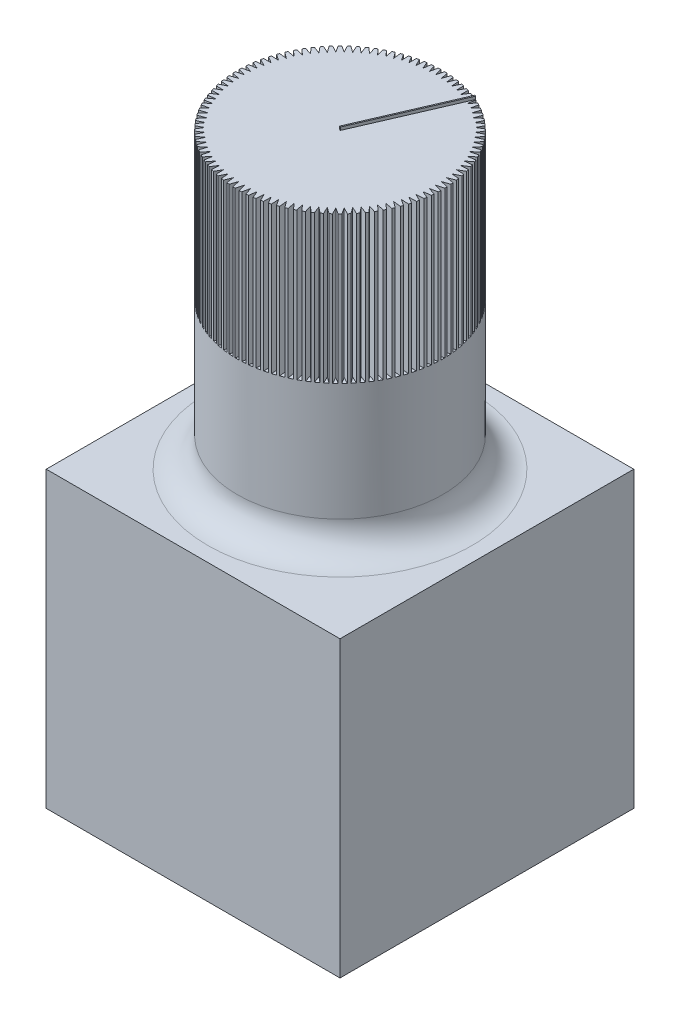
from build123d import *

# Parameters (mm, degrees)
SKETCH1_W           = 10
SKETCH1_H           = 10
BOSS_EXTRUDE1_DEPTH = 10
SKETCH2_R           = 3.5
BOSS_EXTRUDE2_DEPTH = 10
FILLET1_R           = 1
CUT_EXTRUDE3_START  = -5
CUT_EXTRUDE3_DEPTH  = 5
BOSS_EXTRUDE3_DEPTH = 0.1


with BuildPart() as part:
    # Sketch1 → Boss-Extrude1 (new body)
    with BuildSketch(Plane(origin=(0, 0, 0), x_dir=(1, 0, 0), z_dir=(0, 1, 0))):
        Rectangle(SKETCH1_W, SKETCH1_H)
    extrude(amount=BOSS_EXTRUDE1_DEPTH)

    # Sketch2 → Boss-Extrude2 (add)
    with BuildSketch(Plane(origin=(0, 10, 0), x_dir=(1, 0, 0), z_dir=(0, 1, 0))):
        Circle(SKETCH2_R)
    extrude(amount=BOSS_EXTRUDE2_DEPTH)

    # Fillet1
    fillet1_edges = [part.edges().sort_by_distance(p)[0] for p in [
        (-3.5, 10, 0),
    ]]
    fillet(fillet1_edges, radius=FILLET1_R)

    # Sketch5 → Cut-Extrude3 (cut)
    with BuildSketch(Plane(origin=(0, 20, 0), x_dir=(1, 0, 0), z_dir=(0, 1, 0)).offset(CUT_EXTRUDE3_START)):
        with BuildLine():
            Line((0, 3.25), (-0.066816391, 3.499362166))
            ThreePointArc((-0.066816391, 3.499362166), (0, 3.5), (0.066816391, 3.499362166))
            Line((0.066816391, 3.499362166), (0, 3.25))
        make_face()
        with BuildLine():
            Line((0.204069188, 3.243586867), (0.153042224, 3.49665241))
            ThreePointArc((0.153042224, 3.49665241), (0.219766818, 3.493093549), (0.286411313, 3.488261538))
            Line((0.286411313, 3.488261538), (0.204069188, 3.243586867))
        make_face()
        with BuildLine():
            Line((0.407333009, 3.224372779), (0.372296852, 3.480142965))
            ThreePointArc((0.372296852, 3.480142965), (0.438666317, 3.472401455), (0.5048759, 3.463394336))
            Line((0.5048759, 3.463394336), (0.407333009, 3.224372779))
        make_face()
        with BuildLine():
            Line((0.608989272, 3.192433565), (0.590082194, 3.449898985))
            ThreePointArc((0.590082194, 3.449898985), (0.655834601, 3.438005378), (0.721347972, 3.424858698))
            Line((0.721347972, 3.424858698), (0.608989272, 3.192433565))
        make_face()
        with BuildLine():
            Line((0.808242133, 3.147895274), (0.805538751, 3.40603983))
            ThreePointArc((0.805538751, 3.40603983), (0.870414605, 3.390041064), (0.934973214, 3.372806708))
            Line((0.934973214, 3.372806708), (0.808242133, 3.147895274))
        make_face()
        with BuildLine():
            Line((1.004305232, 3.090933678), (1.017816215, 3.348738591))
            ThreePointArc((1.017816215, 3.348738591), (1.08155948, 3.328697807), (1.144908543, 3.307443791))
            Line((1.144908543, 3.307443791), (1.004305232, 3.090933678))
        make_face()
        with BuildLine():
            Line((1.196404796, 3.021773579), (1.226076823, 3.278221412))
            ThreePointArc((1.226076823, 3.278221412), (1.288435934, 3.254217701), (1.350325441, 3.229027904))
            Line((1.350325441, 3.229027904), (1.196404796, 3.021773579))
        make_face()
        with BuildLine():
            Line((1.383782698, 2.940687921), (1.429498666, 3.19476659))
            ThreePointArc((1.429498666, 3.19476659), (1.49022752, 3.166894684), (1.550413222, 3.137868519))
            Line((1.550413222, 3.137868519), (1.383782698, 2.940687921))
        make_face()
        with BuildLine():
            Line((1.565699441, 2.84799671), (1.627278931, 3.098703484))
            ThreePointArc((1.627278931, 3.098703484), (1.686137859, 3.06707338), (1.74438223, 3.0343254))
            Line((1.74438223, 3.0343254), (1.565699441, 2.84799671))
        make_face()
        with BuildLine():
            Line((1.741437084, 2.744065758), (1.818637069, 2.990411211))
            ThreePointArc((1.818637069, 2.990411211), (1.875393782, 2.955147739), (1.931466959, 2.918807186))
            Line((1.931466959, 2.918807186), (1.741437084, 2.744065758))
        make_face()
        with BuildLine():
            Line((1.91030207, 2.629305232), (2.002817878, 2.870317151))
            ThreePointArc((2.002817878, 2.870317151), (2.057248383, 2.83155948), (2.11092907, 2.791769773))
            Line((2.11092907, 2.791769773), (1.91030207, 2.629305232))
        make_face()
        with BuildLine():
            Line((2.071627967, 2.504168039), (2.179094479, 2.738895261))
            ThreePointArc((2.179094479, 2.738895261), (2.230983964, 2.69679635), (2.282060308, 2.65371452))
            Line((2.282060308, 2.65371452), (2.071627967, 2.504168039))
        make_face()
        with BuildLine():
            Line((2.224778094, 2.369148039), (2.346771191, 2.596664202))
            ThreePointArc((2.346771191, 2.596664202), (2.395914871, 2.551390196), (2.444185296, 2.505186268))
            Line((2.444185296, 2.505186268), (2.224778094, 2.369148039))
        make_face()
        with BuildLine():
            Line((2.369148039, 2.224778094), (2.505186268, 2.444185296))
            ThreePointArc((2.505186268, 2.444185296), (2.551390196, 2.395914871), (2.596664202, 2.346771191))
            Line((2.596664202, 2.346771191), (2.369148039, 2.224778094))
        make_face()
        with BuildLine():
            Line((2.504168039, 2.071627967), (2.65371452, 2.282060308))
            ThreePointArc((2.65371452, 2.282060308), (2.69679635, 2.230983964), (2.738895261, 2.179094479))
            Line((2.738895261, 2.179094479), (2.504168039, 2.071627967))
        make_face()
        with BuildLine():
            Line((2.629305232, 1.91030207), (2.791769773, 2.11092907))
            ThreePointArc((2.791769773, 2.11092907), (2.83155948, 2.057248383), (2.870317151, 2.002817878))
            Line((2.870317151, 2.002817878), (2.629305232, 1.91030207))
        make_face()
        with BuildLine():
            Line((2.744065758, 1.741437084), (2.918807186, 1.931466959))
            ThreePointArc((2.918807186, 1.931466959), (2.955147739, 1.875393782), (2.990411211, 1.818637069))
            Line((2.990411211, 1.818637069), (2.744065758, 1.741437084))
        make_face()
        with BuildLine():
            Line((2.84799671, 1.565699441), (3.0343254, 1.74438223))
            ThreePointArc((3.0343254, 1.74438223), (3.06707338, 1.686137859), (3.098703484, 1.627278931))
            Line((3.098703484, 1.627278931), (2.84799671, 1.565699441))
        make_face()
        with BuildLine():
            Line((2.940687921, 1.383782698), (3.137868519, 1.550413222))
            ThreePointArc((3.137868519, 1.550413222), (3.166894684, 1.49022752), (3.19476659, 1.429498666))
            Line((3.19476659, 1.429498666), (2.940687921, 1.383782698))
        make_face()
        with BuildLine():
            Line((3.021773579, 1.196404796), (3.229027904, 1.350325441))
            ThreePointArc((3.229027904, 1.350325441), (3.254217701, 1.288435934), (3.278221412, 1.226076823))
            Line((3.278221412, 1.226076823), (3.021773579, 1.196404796))
        make_face()
        with BuildLine():
            Line((3.090933678, 1.004305232), (3.307443791, 1.144908543))
            ThreePointArc((3.307443791, 1.144908543), (3.328697807, 1.08155948), (3.348738591, 1.017816215))
            Line((3.348738591, 1.017816215), (3.090933678, 1.004305232))
        make_face()
        with BuildLine():
            Line((3.147895274, 0.808242133), (3.372806708, 0.934973214))
            ThreePointArc((3.372806708, 0.934973214), (3.390041064, 0.870414605), (3.40603983, 0.805538751))
            Line((3.40603983, 0.805538751), (3.147895274, 0.808242133))
        make_face()
        with BuildLine():
            Line((3.192433565, 0.608989272), (3.424858698, 0.721347972))
            ThreePointArc((3.424858698, 0.721347972), (3.438005378, 0.655834601), (3.449898985, 0.590082194))
            Line((3.449898985, 0.590082194), (3.192433565, 0.608989272))
        make_face()
        with BuildLine():
            Line((3.224372779, 0.407333009), (3.463394336, 0.5048759))
            ThreePointArc((3.463394336, 0.5048759), (3.472401455, 0.438666317), (3.480142965, 0.372296852))
            Line((3.480142965, 0.372296852), (3.224372779, 0.407333009))
        make_face()
        with BuildLine():
            Line((3.243586867, 0.204069188), (3.488261538, 0.286411313))
            ThreePointArc((3.488261538, 0.286411313), (3.493093549, 0.219766818), (3.49665241, 0.153042224))
            Line((3.49665241, 0.153042224), (3.243586867, 0.204069188))
        make_face()
        with BuildLine():
            Line((3.25, 0), (3.499362166, 0.066816391))
            ThreePointArc((3.499362166, 0.066816391), (3.5, 0), (3.499362166, -0.066816391))
            Line((3.499362166, -0.066816391), (3.25, 0))
        make_face()
        with BuildLine():
            Line((3.243586867, -0.204069188), (3.49665241, -0.153042224))
            ThreePointArc((3.49665241, -0.153042224), (3.493093549, -0.219766818), (3.488261538, -0.286411313))
            Line((3.488261538, -0.286411313), (3.243586867, -0.204069188))
        make_face()
        with BuildLine():
            Line((3.224372779, -0.407333009), (3.480142965, -0.372296852))
            ThreePointArc((3.480142965, -0.372296852), (3.472401455, -0.438666317), (3.463394336, -0.5048759))
            Line((3.463394336, -0.5048759), (3.224372779, -0.407333009))
        make_face()
        with BuildLine():
            Line((3.192433565, -0.608989272), (3.449898985, -0.590082194))
            ThreePointArc((3.449898985, -0.590082194), (3.438005378, -0.655834601), (3.424858698, -0.721347972))
            Line((3.424858698, -0.721347972), (3.192433565, -0.608989272))
        make_face()
        with BuildLine():
            Line((3.147895274, -0.808242133), (3.40603983, -0.805538751))
            ThreePointArc((3.40603983, -0.805538751), (3.390041064, -0.870414605), (3.372806708, -0.934973214))
            Line((3.372806708, -0.934973214), (3.147895274, -0.808242133))
        make_face()
        with BuildLine():
            Line((3.090933678, -1.004305232), (3.348738591, -1.017816215))
            ThreePointArc((3.348738591, -1.017816215), (3.328697807, -1.08155948), (3.307443791, -1.144908543))
            Line((3.307443791, -1.144908543), (3.090933678, -1.004305232))
        make_face()
        with BuildLine():
            Line((3.021773579, -1.196404796), (3.278221412, -1.226076823))
            ThreePointArc((3.278221412, -1.226076823), (3.254217701, -1.288435934), (3.229027904, -1.350325441))
            Line((3.229027904, -1.350325441), (3.021773579, -1.196404796))
        make_face()
        with BuildLine():
            Line((2.940687921, -1.383782698), (3.19476659, -1.429498666))
            ThreePointArc((3.19476659, -1.429498666), (3.166894684, -1.49022752), (3.137868519, -1.550413222))
            Line((3.137868519, -1.550413222), (2.940687921, -1.383782698))
        make_face()
        with BuildLine():
            Line((2.84799671, -1.565699441), (3.098703484, -1.627278931))
            ThreePointArc((3.098703484, -1.627278931), (3.06707338, -1.686137859), (3.0343254, -1.74438223))
            Line((3.0343254, -1.74438223), (2.84799671, -1.565699441))
        make_face()
        with BuildLine():
            Line((2.744065758, -1.741437084), (2.990411211, -1.818637069))
            ThreePointArc((2.990411211, -1.818637069), (2.955147739, -1.875393782), (2.918807186, -1.931466959))
            Line((2.918807186, -1.931466959), (2.744065758, -1.741437084))
        make_face()
        with BuildLine():
            Line((2.629305232, -1.91030207), (2.870317151, -2.002817878))
            ThreePointArc((2.870317151, -2.002817878), (2.83155948, -2.057248383), (2.791769773, -2.11092907))
            Line((2.791769773, -2.11092907), (2.629305232, -1.91030207))
        make_face()
        with BuildLine():
            Line((2.504168039, -2.071627967), (2.738895261, -2.179094479))
            ThreePointArc((2.738895261, -2.179094479), (2.69679635, -2.230983964), (2.65371452, -2.282060308))
            Line((2.65371452, -2.282060308), (2.504168039, -2.071627967))
        make_face()
        with BuildLine():
            Line((2.369148039, -2.224778094), (2.596664202, -2.346771191))
            ThreePointArc((2.596664202, -2.346771191), (2.551390196, -2.395914871), (2.505186268, -2.444185296))
            Line((2.505186268, -2.444185296), (2.369148039, -2.224778094))
        make_face()
        with BuildLine():
            Line((2.224778094, -2.369148039), (2.444185296, -2.505186268))
            ThreePointArc((2.444185296, -2.505186268), (2.395914871, -2.551390196), (2.346771191, -2.596664202))
            Line((2.346771191, -2.596664202), (2.224778094, -2.369148039))
        make_face()
        with BuildLine():
            Line((2.071627967, -2.504168039), (2.282060308, -2.65371452))
            ThreePointArc((2.282060308, -2.65371452), (2.230983964, -2.69679635), (2.179094479, -2.738895261))
            Line((2.179094479, -2.738895261), (2.071627967, -2.504168039))
        make_face()
        with BuildLine():
            Line((1.91030207, -2.629305232), (2.11092907, -2.791769773))
            ThreePointArc((2.11092907, -2.791769773), (2.057248383, -2.83155948), (2.002817878, -2.870317151))
            Line((2.002817878, -2.870317151), (1.91030207, -2.629305232))
        make_face()
        with BuildLine():
            Line((1.741437084, -2.744065758), (1.931466959, -2.918807186))
            ThreePointArc((1.931466959, -2.918807186), (1.875393782, -2.955147739), (1.818637069, -2.990411211))
            Line((1.818637069, -2.990411211), (1.741437084, -2.744065758))
        make_face()
        with BuildLine():
            Line((1.565699441, -2.84799671), (1.74438223, -3.0343254))
            ThreePointArc((1.74438223, -3.0343254), (1.686137859, -3.06707338), (1.627278931, -3.098703484))
            Line((1.627278931, -3.098703484), (1.565699441, -2.84799671))
        make_face()
        with BuildLine():
            Line((1.383782698, -2.940687921), (1.550413222, -3.137868519))
            ThreePointArc((1.550413222, -3.137868519), (1.49022752, -3.166894684), (1.429498666, -3.19476659))
            Line((1.429498666, -3.19476659), (1.383782698, -2.940687921))
        make_face()
        with BuildLine():
            Line((1.196404796, -3.021773579), (1.350325441, -3.229027904))
            ThreePointArc((1.350325441, -3.229027904), (1.288435934, -3.254217701), (1.226076823, -3.278221412))
            Line((1.226076823, -3.278221412), (1.196404796, -3.021773579))
        make_face()
        with BuildLine():
            Line((1.004305232, -3.090933678), (1.144908543, -3.307443791))
            ThreePointArc((1.144908543, -3.307443791), (1.08155948, -3.328697807), (1.017816215, -3.348738591))
            Line((1.017816215, -3.348738591), (1.004305232, -3.090933678))
        make_face()
        with BuildLine():
            Line((0.808242133, -3.147895274), (0.934973214, -3.372806708))
            ThreePointArc((0.934973214, -3.372806708), (0.870414605, -3.390041064), (0.805538751, -3.40603983))
            Line((0.805538751, -3.40603983), (0.808242133, -3.147895274))
        make_face()
        with BuildLine():
            Line((0.608989272, -3.192433565), (0.721347972, -3.424858698))
            ThreePointArc((0.721347972, -3.424858698), (0.655834601, -3.438005378), (0.590082194, -3.449898985))
            Line((0.590082194, -3.449898985), (0.608989272, -3.192433565))
        make_face()
        with BuildLine():
            Line((0.407333009, -3.224372779), (0.5048759, -3.463394336))
            ThreePointArc((0.5048759, -3.463394336), (0.438666317, -3.472401455), (0.372296852, -3.480142965))
            Line((0.372296852, -3.480142965), (0.407333009, -3.224372779))
        make_face()
        with BuildLine():
            Line((0.204069188, -3.243586867), (0.286411313, -3.488261538))
            ThreePointArc((0.286411313, -3.488261538), (0.219766818, -3.493093549), (0.153042224, -3.49665241))
            Line((0.153042224, -3.49665241), (0.204069188, -3.243586867))
        make_face()
        with BuildLine():
            Line((0, -3.25), (0.066816391, -3.499362166))
            ThreePointArc((0.066816391, -3.499362166), (0, -3.5), (-0.066816391, -3.499362166))
            Line((-0.066816391, -3.499362166), (0, -3.25))
        make_face()
        with BuildLine():
            Line((-0.204069188, -3.243586867), (-0.153042224, -3.49665241))
            ThreePointArc((-0.153042224, -3.49665241), (-0.219766818, -3.493093549), (-0.286411313, -3.488261538))
            Line((-0.286411313, -3.488261538), (-0.204069188, -3.243586867))
        make_face()
        with BuildLine():
            Line((-0.407333009, -3.224372779), (-0.372296852, -3.480142965))
            ThreePointArc((-0.372296852, -3.480142965), (-0.438666317, -3.472401455), (-0.5048759, -3.463394336))
            Line((-0.5048759, -3.463394336), (-0.407333009, -3.224372779))
        make_face()
        with BuildLine():
            Line((-0.608989272, -3.192433565), (-0.590082194, -3.449898985))
            ThreePointArc((-0.590082194, -3.449898985), (-0.655834601, -3.438005378), (-0.721347972, -3.424858698))
            Line((-0.721347972, -3.424858698), (-0.608989272, -3.192433565))
        make_face()
        with BuildLine():
            Line((-0.808242133, -3.147895274), (-0.805538751, -3.40603983))
            ThreePointArc((-0.805538751, -3.40603983), (-0.870414605, -3.390041064), (-0.934973214, -3.372806708))
            Line((-0.934973214, -3.372806708), (-0.808242133, -3.147895274))
        make_face()
        with BuildLine():
            Line((-1.004305232, -3.090933678), (-1.017816215, -3.348738591))
            ThreePointArc((-1.017816215, -3.348738591), (-1.08155948, -3.328697807), (-1.144908543, -3.307443791))
            Line((-1.144908543, -3.307443791), (-1.004305232, -3.090933678))
        make_face()
        with BuildLine():
            Line((-1.196404796, -3.021773579), (-1.226076823, -3.278221412))
            ThreePointArc((-1.226076823, -3.278221412), (-1.288435934, -3.254217701), (-1.350325441, -3.229027904))
            Line((-1.350325441, -3.229027904), (-1.196404796, -3.021773579))
        make_face()
        with BuildLine():
            Line((-1.383782698, -2.940687921), (-1.429498666, -3.19476659))
            ThreePointArc((-1.429498666, -3.19476659), (-1.49022752, -3.166894684), (-1.550413222, -3.137868519))
            Line((-1.550413222, -3.137868519), (-1.383782698, -2.940687921))
        make_face()
        with BuildLine():
            Line((-1.565699441, -2.84799671), (-1.627278931, -3.098703484))
            ThreePointArc((-1.627278931, -3.098703484), (-1.686137859, -3.06707338), (-1.74438223, -3.0343254))
            Line((-1.74438223, -3.0343254), (-1.565699441, -2.84799671))
        make_face()
        with BuildLine():
            Line((-1.741437084, -2.744065758), (-1.818637069, -2.990411211))
            ThreePointArc((-1.818637069, -2.990411211), (-1.875393782, -2.955147739), (-1.931466959, -2.918807186))
            Line((-1.931466959, -2.918807186), (-1.741437084, -2.744065758))
        make_face()
        with BuildLine():
            Line((-1.91030207, -2.629305232), (-2.002817878, -2.870317151))
            ThreePointArc((-2.002817878, -2.870317151), (-2.057248383, -2.83155948), (-2.11092907, -2.791769773))
            Line((-2.11092907, -2.791769773), (-1.91030207, -2.629305232))
        make_face()
        with BuildLine():
            Line((-2.071627967, -2.504168039), (-2.179094479, -2.738895261))
            ThreePointArc((-2.179094479, -2.738895261), (-2.230983964, -2.69679635), (-2.282060308, -2.65371452))
            Line((-2.282060308, -2.65371452), (-2.071627967, -2.504168039))
        make_face()
        with BuildLine():
            Line((-2.224778094, -2.369148039), (-2.346771191, -2.596664202))
            ThreePointArc((-2.346771191, -2.596664202), (-2.395914871, -2.551390196), (-2.444185296, -2.505186268))
            Line((-2.444185296, -2.505186268), (-2.224778094, -2.369148039))
        make_face()
        with BuildLine():
            Line((-2.369148039, -2.224778094), (-2.505186268, -2.444185296))
            ThreePointArc((-2.505186268, -2.444185296), (-2.551390196, -2.395914871), (-2.596664202, -2.346771191))
            Line((-2.596664202, -2.346771191), (-2.369148039, -2.224778094))
        make_face()
        with BuildLine():
            Line((-2.504168039, -2.071627967), (-2.65371452, -2.282060308))
            ThreePointArc((-2.65371452, -2.282060308), (-2.69679635, -2.230983964), (-2.738895261, -2.179094479))
            Line((-2.738895261, -2.179094479), (-2.504168039, -2.071627967))
        make_face()
        with BuildLine():
            Line((-2.629305232, -1.91030207), (-2.791769773, -2.11092907))
            ThreePointArc((-2.791769773, -2.11092907), (-2.83155948, -2.057248383), (-2.870317151, -2.002817878))
            Line((-2.870317151, -2.002817878), (-2.629305232, -1.91030207))
        make_face()
        with BuildLine():
            Line((-2.744065758, -1.741437084), (-2.918807186, -1.931466959))
            ThreePointArc((-2.918807186, -1.931466959), (-2.955147739, -1.875393782), (-2.990411211, -1.818637069))
            Line((-2.990411211, -1.818637069), (-2.744065758, -1.741437084))
        make_face()
        with BuildLine():
            Line((-2.84799671, -1.565699441), (-3.0343254, -1.74438223))
            ThreePointArc((-3.0343254, -1.74438223), (-3.06707338, -1.686137859), (-3.098703484, -1.627278931))
            Line((-3.098703484, -1.627278931), (-2.84799671, -1.565699441))
        make_face()
        with BuildLine():
            Line((-2.940687921, -1.383782698), (-3.137868519, -1.550413222))
            ThreePointArc((-3.137868519, -1.550413222), (-3.166894684, -1.49022752), (-3.19476659, -1.429498666))
            Line((-3.19476659, -1.429498666), (-2.940687921, -1.383782698))
        make_face()
        with BuildLine():
            Line((-3.021773579, -1.196404796), (-3.229027904, -1.350325441))
            ThreePointArc((-3.229027904, -1.350325441), (-3.254217701, -1.288435934), (-3.278221412, -1.226076823))
            Line((-3.278221412, -1.226076823), (-3.021773579, -1.196404796))
        make_face()
        with BuildLine():
            Line((-3.090933678, -1.004305232), (-3.307443791, -1.144908543))
            ThreePointArc((-3.307443791, -1.144908543), (-3.328697807, -1.08155948), (-3.348738591, -1.017816215))
            Line((-3.348738591, -1.017816215), (-3.090933678, -1.004305232))
        make_face()
        with BuildLine():
            Line((-3.147895274, -0.808242133), (-3.372806708, -0.934973214))
            ThreePointArc((-3.372806708, -0.934973214), (-3.390041064, -0.870414605), (-3.40603983, -0.805538751))
            Line((-3.40603983, -0.805538751), (-3.147895274, -0.808242133))
        make_face()
        with BuildLine():
            Line((-3.192433565, -0.608989272), (-3.424858698, -0.721347972))
            ThreePointArc((-3.424858698, -0.721347972), (-3.438005378, -0.655834601), (-3.449898985, -0.590082194))
            Line((-3.449898985, -0.590082194), (-3.192433565, -0.608989272))
        make_face()
        with BuildLine():
            Line((-3.224372779, -0.407333009), (-3.463394336, -0.5048759))
            ThreePointArc((-3.463394336, -0.5048759), (-3.472401455, -0.438666317), (-3.480142965, -0.372296852))
            Line((-3.480142965, -0.372296852), (-3.224372779, -0.407333009))
        make_face()
        with BuildLine():
            Line((-3.243586867, -0.204069188), (-3.488261538, -0.286411313))
            ThreePointArc((-3.488261538, -0.286411313), (-3.493093549, -0.219766818), (-3.49665241, -0.153042224))
            Line((-3.49665241, -0.153042224), (-3.243586867, -0.204069188))
        make_face()
        with BuildLine():
            Line((-3.25, 0), (-3.499362166, -0.066816391))
            ThreePointArc((-3.499362166, -0.066816391), (-3.5, 0), (-3.499362166, 0.066816391))
            Line((-3.499362166, 0.066816391), (-3.25, 0))
        make_face()
        with BuildLine():
            Line((-3.243586867, 0.204069188), (-3.49665241, 0.153042224))
            ThreePointArc((-3.49665241, 0.153042224), (-3.493093549, 0.219766818), (-3.488261538, 0.286411313))
            Line((-3.488261538, 0.286411313), (-3.243586867, 0.204069188))
        make_face()
        with BuildLine():
            Line((-3.224372779, 0.407333009), (-3.480142965, 0.372296852))
            ThreePointArc((-3.480142965, 0.372296852), (-3.472401455, 0.438666317), (-3.463394336, 0.5048759))
            Line((-3.463394336, 0.5048759), (-3.224372779, 0.407333009))
        make_face()
        with BuildLine():
            Line((-3.192433565, 0.608989272), (-3.449898985, 0.590082194))
            ThreePointArc((-3.449898985, 0.590082194), (-3.438005378, 0.655834601), (-3.424858698, 0.721347972))
            Line((-3.424858698, 0.721347972), (-3.192433565, 0.608989272))
        make_face()
        with BuildLine():
            Line((-3.147895274, 0.808242133), (-3.40603983, 0.805538751))
            ThreePointArc((-3.40603983, 0.805538751), (-3.390041064, 0.870414605), (-3.372806708, 0.934973214))
            Line((-3.372806708, 0.934973214), (-3.147895274, 0.808242133))
        make_face()
        with BuildLine():
            Line((-3.090933678, 1.004305232), (-3.348738591, 1.017816215))
            ThreePointArc((-3.348738591, 1.017816215), (-3.328697807, 1.08155948), (-3.307443791, 1.144908543))
            Line((-3.307443791, 1.144908543), (-3.090933678, 1.004305232))
        make_face()
        with BuildLine():
            Line((-3.021773579, 1.196404796), (-3.278221412, 1.226076823))
            ThreePointArc((-3.278221412, 1.226076823), (-3.254217701, 1.288435934), (-3.229027904, 1.350325441))
            Line((-3.229027904, 1.350325441), (-3.021773579, 1.196404796))
        make_face()
        with BuildLine():
            Line((-2.940687921, 1.383782698), (-3.19476659, 1.429498666))
            ThreePointArc((-3.19476659, 1.429498666), (-3.166894684, 1.49022752), (-3.137868519, 1.550413222))
            Line((-3.137868519, 1.550413222), (-2.940687921, 1.383782698))
        make_face()
        with BuildLine():
            Line((-2.84799671, 1.565699441), (-3.098703484, 1.627278931))
            ThreePointArc((-3.098703484, 1.627278931), (-3.06707338, 1.686137859), (-3.0343254, 1.74438223))
            Line((-3.0343254, 1.74438223), (-2.84799671, 1.565699441))
        make_face()
        with BuildLine():
            Line((-2.744065758, 1.741437084), (-2.990411211, 1.818637069))
            ThreePointArc((-2.990411211, 1.818637069), (-2.955147739, 1.875393782), (-2.918807186, 1.931466959))
            Line((-2.918807186, 1.931466959), (-2.744065758, 1.741437084))
        make_face()
        with BuildLine():
            Line((-2.629305232, 1.91030207), (-2.870317151, 2.002817878))
            ThreePointArc((-2.870317151, 2.002817878), (-2.83155948, 2.057248383), (-2.791769773, 2.11092907))
            Line((-2.791769773, 2.11092907), (-2.629305232, 1.91030207))
        make_face()
        with BuildLine():
            Line((-2.504168039, 2.071627967), (-2.738895261, 2.179094479))
            ThreePointArc((-2.738895261, 2.179094479), (-2.69679635, 2.230983964), (-2.65371452, 2.282060308))
            Line((-2.65371452, 2.282060308), (-2.504168039, 2.071627967))
        make_face()
        with BuildLine():
            Line((-2.369148039, 2.224778094), (-2.596664202, 2.346771191))
            ThreePointArc((-2.596664202, 2.346771191), (-2.551390196, 2.395914871), (-2.505186268, 2.444185296))
            Line((-2.505186268, 2.444185296), (-2.369148039, 2.224778094))
        make_face()
        with BuildLine():
            Line((-2.224778094, 2.369148039), (-2.444185296, 2.505186268))
            ThreePointArc((-2.444185296, 2.505186268), (-2.395914871, 2.551390196), (-2.346771191, 2.596664202))
            Line((-2.346771191, 2.596664202), (-2.224778094, 2.369148039))
        make_face()
        with BuildLine():
            Line((-2.071627967, 2.504168039), (-2.282060308, 2.65371452))
            ThreePointArc((-2.282060308, 2.65371452), (-2.230983964, 2.69679635), (-2.179094479, 2.738895261))
            Line((-2.179094479, 2.738895261), (-2.071627967, 2.504168039))
        make_face()
        with BuildLine():
            Line((-1.91030207, 2.629305232), (-2.11092907, 2.791769773))
            ThreePointArc((-2.11092907, 2.791769773), (-2.057248383, 2.83155948), (-2.002817878, 2.870317151))
            Line((-2.002817878, 2.870317151), (-1.91030207, 2.629305232))
        make_face()
        with BuildLine():
            Line((-1.741437084, 2.744065758), (-1.931466959, 2.918807186))
            ThreePointArc((-1.931466959, 2.918807186), (-1.875393782, 2.955147739), (-1.818637069, 2.990411211))
            Line((-1.818637069, 2.990411211), (-1.741437084, 2.744065758))
        make_face()
        with BuildLine():
            Line((-1.565699441, 2.84799671), (-1.74438223, 3.0343254))
            ThreePointArc((-1.74438223, 3.0343254), (-1.686137859, 3.06707338), (-1.627278931, 3.098703484))
            Line((-1.627278931, 3.098703484), (-1.565699441, 2.84799671))
        make_face()
        with BuildLine():
            Line((-1.383782698, 2.940687921), (-1.550413222, 3.137868519))
            ThreePointArc((-1.550413222, 3.137868519), (-1.49022752, 3.166894684), (-1.429498666, 3.19476659))
            Line((-1.429498666, 3.19476659), (-1.383782698, 2.940687921))
        make_face()
        with BuildLine():
            Line((-1.196404796, 3.021773579), (-1.350325441, 3.229027904))
            ThreePointArc((-1.350325441, 3.229027904), (-1.288435934, 3.254217701), (-1.226076823, 3.278221412))
            Line((-1.226076823, 3.278221412), (-1.196404796, 3.021773579))
        make_face()
        with BuildLine():
            Line((-1.004305232, 3.090933678), (-1.144908543, 3.307443791))
            ThreePointArc((-1.144908543, 3.307443791), (-1.08155948, 3.328697807), (-1.017816215, 3.348738591))
            Line((-1.017816215, 3.348738591), (-1.004305232, 3.090933678))
        make_face()
        with BuildLine():
            Line((-0.808242133, 3.147895274), (-0.934973214, 3.372806708))
            ThreePointArc((-0.934973214, 3.372806708), (-0.870414605, 3.390041064), (-0.805538751, 3.40603983))
            Line((-0.805538751, 3.40603983), (-0.808242133, 3.147895274))
        make_face()
        with BuildLine():
            Line((-0.608989272, 3.192433565), (-0.721347972, 3.424858698))
            ThreePointArc((-0.721347972, 3.424858698), (-0.655834601, 3.438005378), (-0.590082194, 3.449898985))
            Line((-0.590082194, 3.449898985), (-0.608989272, 3.192433565))
        make_face()
        with BuildLine():
            Line((-0.407333009, 3.224372779), (-0.5048759, 3.463394336))
            ThreePointArc((-0.5048759, 3.463394336), (-0.438666317, 3.472401455), (-0.372296852, 3.480142965))
            Line((-0.372296852, 3.480142965), (-0.407333009, 3.224372779))
        make_face()
        with BuildLine():
            Line((-0.204069188, 3.243586867), (-0.286411313, 3.488261538))
            ThreePointArc((-0.286411313, 3.488261538), (-0.219766818, 3.493093549), (-0.153042224, 3.49665241))
            Line((-0.153042224, 3.49665241), (-0.204069188, 3.243586867))
        make_face()
    extrude(amount=CUT_EXTRUDE3_DEPTH, mode=Mode.SUBTRACT)

    # Sketch6 → Boss-Extrude3 (add)
    with BuildSketch(Plane(origin=(0, 20, 0), x_dir=(1, 0, 0), z_dir=(0, 1, 0))):
        Polygon((1.370552232, 3.220564528), (1.410820659, 3.203058705), (0.02014511, -0.008727748), (-0.020148821, 0.008719174), align=None)
    extrude(amount=BOSS_EXTRUDE3_DEPTH)


solid = part.part
